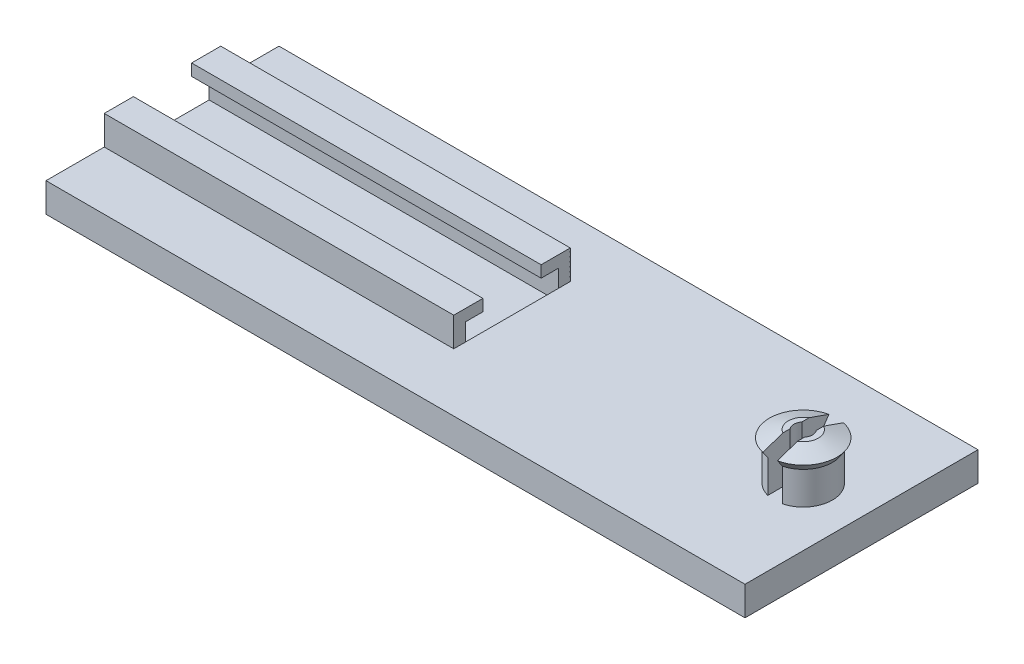
from build123d import *

# Parameters (mm, degrees)
SKETCH3_W               = 76.2
SKETCH3_H               = 25.4
BOSS_EXTRUDE1_DEPTH     = 3.175
SKETCH4_W               = 38.1
SKETCH4_H               = 12.7
BOSS_EXTRUDE2_DEPTH     = 3.175
CUT_EXTRUDE1_DEPTH      = 38.1
CUT_EXTRUDE3_DEPTH      = 42.000549082
CUT_EXTRUDE3_DEPTH_BACK = 42.000549082
SKETCH12_W              = 1.5875
SKETCH12_H              = 10.16


with BuildPart() as part:
    # Sketch3 → Boss-Extrude1 (new body)
    with BuildSketch(Plane(origin=(0, 0, 0), x_dir=(1, 0, 0), z_dir=(0, 1, 0))):
        Rectangle(SKETCH3_W, SKETCH3_H)
    extrude(amount=BOSS_EXTRUDE1_DEPTH)

    # Sketch4 → Boss-Extrude2 (add)
    with BuildSketch(Plane(origin=(0, 3.175, 0), x_dir=(1, 0, 0), z_dir=(0, 1, 0))):
        with Locations((-19.05, 0)):
            Rectangle(SKETCH4_W, SKETCH4_H)
    extrude(amount=BOSS_EXTRUDE2_DEPTH)

    # Sketch6 → Cut-Extrude1 (cut)
    with BuildSketch(Plane.ZY.offset(38.1)):
        Polygon((-5.08, 1.905), (-5.08, 5.08), (-3.175, 5.08), (-3.175, 6.35), (3.175, 6.35), (3.175, 5.08), (5.08, 5.08), (5.08, 1.905), align=None)
    extrude(amount=-CUT_EXTRUDE1_DEPTH, mode=Mode.SUBTRACT)

    # Sketch11 → Revolve1 (revolve)
    with BuildSketch(Plane.XY, mode=Mode.PRIVATE) as revolve1_sk:
        Polygon((30.734, 3.175), (28.575, 3.175), (28.575, 6.731), (28.067, 7.493), (30.116415016, 8.255), (30.734, 8.255), align=None)
    revolve(revolve1_sk.sketch.rotate(Axis((31.75, 3.175, 0), (0, 1, 0)), 270), axis=Axis((31.75, 3.175, 0), (0, 1, 0)))

    # Sketch12 → Cut-Extrude3 (cut, two sides: drawn at the far end of the back side and taken through both)
    with BuildSketch(Plane.XY.offset(-CUT_EXTRUDE3_DEPTH_BACK)):
        with Locations((31.75, 8.255)):
            Rectangle(SKETCH12_W, SKETCH12_H)
    extrude(amount=CUT_EXTRUDE3_DEPTH + CUT_EXTRUDE3_DEPTH_BACK, mode=Mode.SUBTRACT)


solid = part.part
